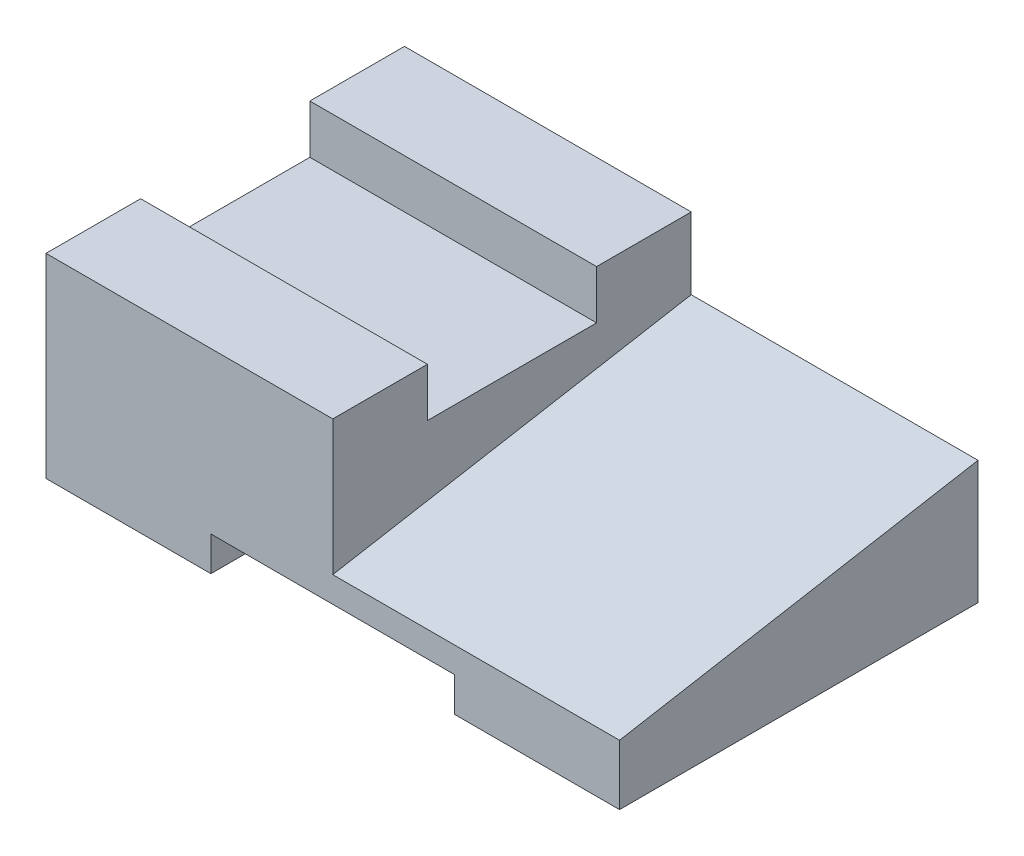
from build123d import *

# Parameters (mm, degrees)
BOSS_EXTRUDE3_DEPTH     = 100
BOSS_EXTRUDE4_DEPTH     = 100
CUT_EXTRUDE1_DEPTH      = 174.922396488
CUT_EXTRUDE1_DEPTH_BACK = 125


with BuildPart() as part:
    # Sketch3 → Boss-Extrude3 (new body)
    with BuildSketch(Plane(origin=(0, 0, 0), x_dir=(0, 0, -1), z_dir=(1, 0, 0))):
        Polygon((33, 68), (0, 68), (0, 0), (125, 0), (125, 68), (92, 68), (92, 51), (33, 51), align=None)
    extrude(amount=-BOSS_EXTRUDE3_DEPTH)

    # Sketch3<3> → Boss-Extrude4 (add)
    with BuildSketch(Plane(origin=(0, 0, 0), x_dir=(0, 0, -1), z_dir=(1, 0, 0))):
        Polygon((125, 43), (0, 20.959127411), (0, 0), (125, 0), align=None)
    extrude(amount=BOSS_EXTRUDE4_DEPTH)

    # Sketch4 → Cut-Extrude1 (cut, two sides: drawn at the far end of the back side and taken through both)
    with BuildSketch(Plane.XY.offset(-CUT_EXTRUDE1_DEPTH_BACK)):
        Polygon((-42.5, -325.78632016), (-42.5, 0), (-42.5, 12), (42.5, 12), (42.5, 0), (42.5, -325.78632016), (42.5, -977.358960479), (-42.5, -977.358960479), align=None)
    extrude(amount=CUT_EXTRUDE1_DEPTH + CUT_EXTRUDE1_DEPTH_BACK, mode=Mode.SUBTRACT)


solid = part.part
